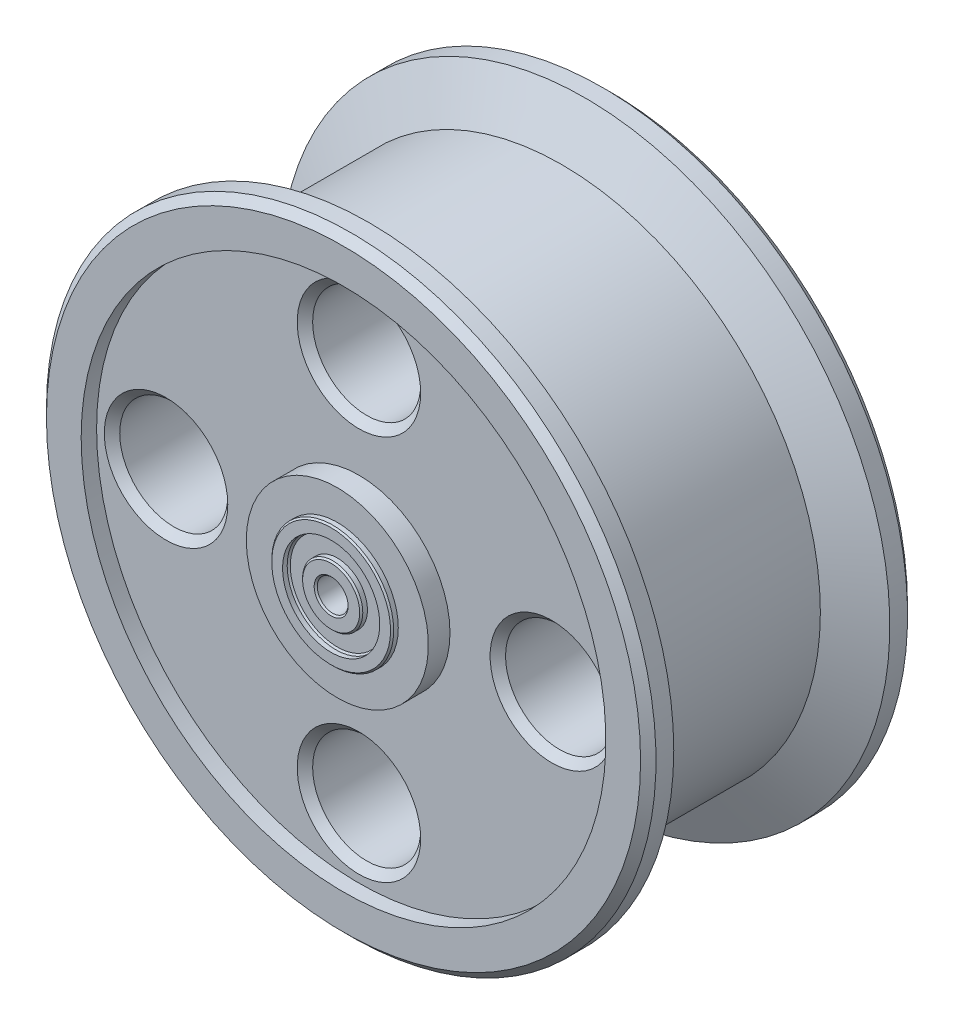
from build123d import *

# Parameters (mm, degrees)
SKETCH2_R               = 50.165
BOSS_EXTRUDE1_DEPTH     = 38.862
SKETCH3_R               = 14.986
BOSS_EXTRUDE2_DEPTH     = 3.556
BOSS_EXTRUDE3_START     = 2.54
SKETCH4_R               = 50.165
SKETCH4_R_2             = 43.18
BOSS_EXTRUDE3_DEPTH     = 2.54
SKETCH5_R               = 8.89
CUT_EXTRUDE1_DEPTH      = 81.890725637
CIRPATTERN1_COUNT       = 4
CUT_EXTRUDE2_DEPTH      = 83.657977074
CUT_EXTRUDE2_DEPTH_BACK = 83.657977074
SKETCH6_R               = 2.54
SKETCH7_R               = 10.033
SKETCH7_R_2             = 8.001
BOSS_EXTRUDE4_DEPTH     = 1.016
SKETCH8_R               = 4.953
SKETCH8_R_2             = 2.54
BOSS_EXTRUDE5_DEPTH     = 1.016
CHAMFER1_SIZE           = 0.254
FILLET1_R               = 0.254
CHAMFER2_SIZE           = 1.27
CHAMFER3_SIZE           = 1.27
CHAMFER4_SIZE           = 0.254


with BuildPart() as part:
    # Sketch2 → Boss-Extrude1 (new body)
    with BuildSketch(Plane.XY):
        Circle(SKETCH2_R)
    extrude(amount=BOSS_EXTRUDE1_DEPTH)

    # Sketch3 → Boss-Extrude2 (add)
    with BuildSketch(Plane(origin=(0, 0, 0), x_dir=(-1, 0, 0), z_dir=(0, 0, -1))):
        Circle(SKETCH3_R)
    boss_extrude2 = extrude(amount=BOSS_EXTRUDE2_DEPTH)

    # Sketch4 → Boss-Extrude3 (add)
    with BuildSketch(Plane(origin=(0, 0, 0), x_dir=(-1, 0, 0), z_dir=(0, 0, -1)).offset(BOSS_EXTRUDE3_START)):
        Circle(SKETCH4_R)
        Circle(SKETCH4_R_2, mode=Mode.SUBTRACT)
    boss_extrude3 = extrude(amount=-BOSS_EXTRUDE3_DEPTH)

    # Sketch5 → Cut-Extrude1 (cut, through all)
    with BuildSketch(Plane(origin=(0, 0, 0), x_dir=(-1, 0, 0), z_dir=(0, 0, -1))):
        with Locations((31.75, 0)):
            Circle(SKETCH5_R)
    cut_extrude1 = extrude(amount=-CUT_EXTRUDE1_DEPTH, mode=Mode.SUBTRACT)

    # CirPattern1: Cut-Extrude1 ×4 about axis
    cirpattern1_axis = Axis((0, 0, 38.862), (0, 0, -1))
    for i in range(1, CIRPATTERN1_COUNT):
        add(cut_extrude1.rotate(cirpattern1_axis, i * 360 / CIRPATTERN1_COUNT), mode=Mode.SUBTRACT)

    # Mirror1: Boss-Extrude3 across plane
    add(boss_extrude3.mirror(Plane(origin=(0, 0, 19.431), x_dir=(1, 0, 0), z_dir=(0, 0, -1))))

    # Mirror2: Boss-Extrude2 across plane
    add(boss_extrude2.mirror(Plane(origin=(0, 0, 19.431), x_dir=(1, 0, 0), z_dir=(0, 0, -1))))

    # Sketch6 → Cut-Extrude2 (cut, two sides: drawn at the far end of the back side and taken through both)
    with BuildSketch(Plane.XY.offset(-CUT_EXTRUDE2_DEPTH_BACK)):
        Circle(SKETCH6_R)
    extrude(amount=CUT_EXTRUDE2_DEPTH + CUT_EXTRUDE2_DEPTH_BACK, mode=Mode.SUBTRACT)

    # Sketch7 → Boss-Extrude4 (add)
    with BuildSketch(Plane(origin=(0, 0, -3.556), x_dir=(-1, 0, 0), z_dir=(0, 0, -1))):
        Circle(SKETCH7_R)
        Circle(SKETCH7_R_2, mode=Mode.SUBTRACT)
    boss_extrude4 = extrude(amount=BOSS_EXTRUDE4_DEPTH)

    # Sketch8 → Boss-Extrude5 (add)
    with BuildSketch(Plane(origin=(0, 0, -3.556), x_dir=(-1, 0, 0), z_dir=(0, 0, -1))):
        Circle(SKETCH8_R)
        Circle(SKETCH8_R_2, mode=Mode.SUBTRACT)
    boss_extrude5 = extrude(amount=BOSS_EXTRUDE5_DEPTH)

    # Chamfer1
    chamfer1_edges = [part.edges().sort_by_distance(p)[0] for p in [
        (8.001, 0, -4.572),
        (10.033, 0, -3.556),
    ]]
    chamfer(chamfer1_edges, length=CHAMFER1_SIZE)

    # Fillet1
    fillet1_edges = [part.edges().sort_by_distance(p)[0] for p in [
        (2.54, 0, -4.572),
        (4.953, 0, -4.572),
    ]]
    fillet(fillet1_edges, radius=FILLET1_R)

    # Chamfer2
    chamfer2_edges = [part.edges().sort_by_distance(p)[0] for p in [
        (0, -22.86, 0),
        (0, -22.86, 38.862),
        (-22.86, 0, 0),
        (-22.86, 0, 38.862),
        (0, 22.86, 0),
        (0, 22.86, 38.862),
        (22.86, 0, 0),
        (22.86, 0, 38.862),
    ]]
    chamfer(chamfer2_edges, length=CHAMFER2_SIZE)

    # Chamfer3
    chamfer3_edges = [part.edges().sort_by_distance(p)[0] for p in [
        (50.165, 0, -2.54),
        (50.165, 0, 41.402),
    ]]
    chamfer(chamfer3_edges, length=CHAMFER3_SIZE)

    # Sketch9 → Cut-Revolve1 (revolve, cut)
    with BuildSketch(Plane(origin=(0, 0, 0), x_dir=(0, 0, -1), z_dir=(1, 0, 0))):
        Polygon((-5.461, 42.545), (-33.401, 42.545), (-37.211, 50.165), (-1.651, 50.165), align=None)
    revolve(axis=Axis((0, 0, 38.862), (0, 0, -1)), mode=Mode.SUBTRACT)

    # Mirror3: Boss-Extrude5 across plane
    add(boss_extrude5.mirror(Plane(origin=(0, 0, 19.431), x_dir=(1, 0, 0), z_dir=(0, 0, -1))))

    # Mirror4: Boss-Extrude4 across plane
    add(boss_extrude4.mirror(Plane(origin=(0, 0, 19.431), x_dir=(1, 0, 0), z_dir=(0, 0, -1))))

    # Chamfer4
    chamfer4_edges = [part.edges().sort_by_distance(p)[0] for p in [
        (8.001, 0, 42.418),
        (2.54, 0, 43.434),
        (4.953, 0, 43.434),
        (10.033, 0, 43.434),
    ]]
    chamfer(chamfer4_edges, length=CHAMFER4_SIZE)


solid = part.part
